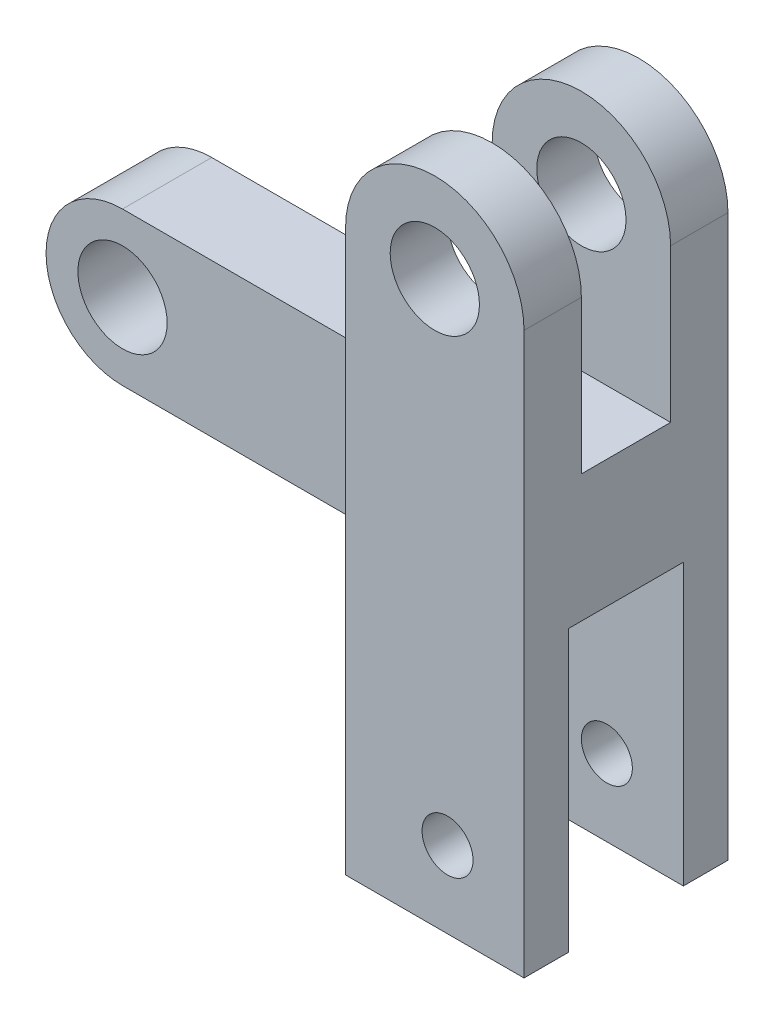
from build123d import *
from build123d.topology import SkipClean

# Parameters (mm, degrees)
SKETCH_1_W          = 7
SKETCH_1_H          = 7
EXTRUDE_1_DEPTH     = 2.4
EXTRUDE_6_DEPTH     = 1.75
EXTRUDE_START       = -5.25
EXTRUDE_8_DEPTH     = 1.75
SKETCH_11_R         = 1.75
CUT_EXTRUDE_1_DEPTH = 17.740669043
SKETCH_17_W         = 7
SKETCH_17_H         = 7
EXTRUDE_10_DEPTH    = 12
SKETCH_15_R         = 1.75
EXTRUDE_9_DEPTH     = 1.75
SKETCH_12_R         = 1
CUT_EXTRUDE_2_DEPTH = 23.383029286
SKETCH_18_W         = 7
SKETCH_18_H         = 4.5
CUT_EXTRUDE_4_DEPTH = 11
SKETCH_19_R         = 1
SKETCH_19_R_2       = 1.75
EXTRUDE_11_DEPTH    = 0.5
EXTRUDE_START_2     = 0.5
SKETCH_20_R         = 1
SKETCH_20_R_2       = 1.75
EXTRUDE_12_DEPTH    = 0.5


with BuildPart() as part:
    # 草图1 → 凸台-拉伸1 (new body)
    with BuildSketch(Plane(origin=(0, 0, 0), x_dir=(1, 0, 0), z_dir=(0, 1, 0))):
        with Locations((3.5, 0)):
            Rectangle(SKETCH_1_W, SKETCH_1_H)
    extrude(amount=EXTRUDE_1_DEPTH)

    # 草图10 → 凸台-拉伸6 (add)
    with BuildSketch(Plane(origin=(0, 0, -3.5), x_dir=(-1, 0, 0), z_dir=(0, 0, -1))):
        with BuildLine():
            Line((-7, 10), (-7, 2.4))
            Line((-7, 2.4), (0, 2.4))
            Line((0, 2.4), (0, 10))
            ThreePointArc((0, 10), (-3.5, 13.5), (-7, 10))
        make_face()
    extrude(amount=-EXTRUDE_6_DEPTH)

    # 草图10<2> → 凸台-拉伸8 (add)
    with BuildSketch(Plane(origin=(0, 0, -3.5), x_dir=(-1, 0, 0), z_dir=(0, 0, -1)).offset(EXTRUDE_START)):
        with BuildLine():
            Line((-7, 10), (-7, 2.4))
            Line((-7, 2.4), (0, 2.4))
            Line((0, 2.4), (0, 10))
            ThreePointArc((0, 10), (-3.5, 13.5), (-7, 10))
        make_face()
    extrude(amount=-EXTRUDE_8_DEPTH)

    # 草图11 → 切除-拉伸1 (cut, through all)
    with BuildSketch(Plane(origin=(0, 0, -3.5), x_dir=(-1, 0, 0), z_dir=(0, 0, -1))):
        with Locations((-3.5, 10)):
            Circle(SKETCH_11_R)
    extrude(amount=-CUT_EXTRUDE_1_DEPTH, mode=Mode.SUBTRACT)

    # 草图17 → 凸台-拉伸10 (add)
    with BuildSketch(Plane.XZ):
        with Locations((3.5, 0)):
            Rectangle(SKETCH_17_W, SKETCH_17_H)
    extrude(amount=EXTRUDE_10_DEPTH)

    # 草图15 → 凸台-拉伸9 (add, symmetric)
    with BuildSketch(Plane.XY):
        with BuildLine():
            Line((7, 2.4), (7, 4))
            Line((7, 4), (-11, 4))
            ThreePointArc((-11, 4), (-14, 1), (-11, -2))
            Line((-11, -2), (7, -2))
            Line((7, -2), (7, 2.4))
        make_face()
        with Locations((-11, 1)):
            Circle(SKETCH_15_R, mode=Mode.SUBTRACT)
    extrude(amount=EXTRUDE_9_DEPTH, both=True)

    # 草图12 → 切除-拉伸2 (cut, through all)
    with BuildSketch(Plane(origin=(0, 4, 3.5), x_dir=(1, 0, 0), z_dir=(0, 0, -1))):
        with Locations((4, 13)):
            Circle(SKETCH_12_R)
    extrude(amount=CUT_EXTRUDE_2_DEPTH, mode=Mode.SUBTRACT)

    # 草图18 → 切除-拉伸4 (cut)
    with BuildSketch(Plane(origin=(7.4, -12, 0), x_dir=(1, 0, 0), z_dir=(0, 1, 0))):
        with Locations((-3.9, 0)):
            Rectangle(SKETCH_18_W, SKETCH_18_H)
    extrude(amount=CUT_EXTRUDE_4_DEPTH, mode=Mode.SUBTRACT)

    # 草图19 → 凸台-拉伸11 (add)
    with SkipClean():  # the faces are left unmerged after this step: merging them gives an invalid solid
        with BuildSketch(Plane.XY.offset(3.5)):
            with BuildLine():
                Line((0, 10), (0, -12))
                Line((0, -12), (7, -12))
                Line((7, -12), (7, 10))
                ThreePointArc((7, 10), (3.5, 13.5), (0, 10))
            make_face()
            with Locations((4, -9)):
                Circle(SKETCH_19_R, mode=Mode.SUBTRACT)
            with Locations((3.5, 10)):
                Circle(SKETCH_19_R_2, mode=Mode.SUBTRACT)
        extrude(amount=EXTRUDE_11_DEPTH)

    # 草图20 → 凸台-拉伸12 (add)
    with SkipClean():  # the faces are left unmerged after this step: merging them gives an invalid solid
        with BuildSketch(Plane(origin=(0, 0, -3.5), x_dir=(-1, 0, 0), z_dir=(0, 0, -1)).offset(EXTRUDE_START_2)):
            with BuildLine():
                Line((-7, 10), (-7, -12))
                Line((-7, -12), (0, -12))
                Line((0, -12), (0, 10))
                ThreePointArc((0, 10), (-3.5, 13.5), (-7, 10))
            make_face()
            with Locations((-4, -9)):
                Circle(SKETCH_20_R, mode=Mode.SUBTRACT)
            with Locations((-3.5, 10)):
                Circle(SKETCH_20_R_2, mode=Mode.SUBTRACT)
        extrude(amount=-EXTRUDE_12_DEPTH)


solid = part.part
